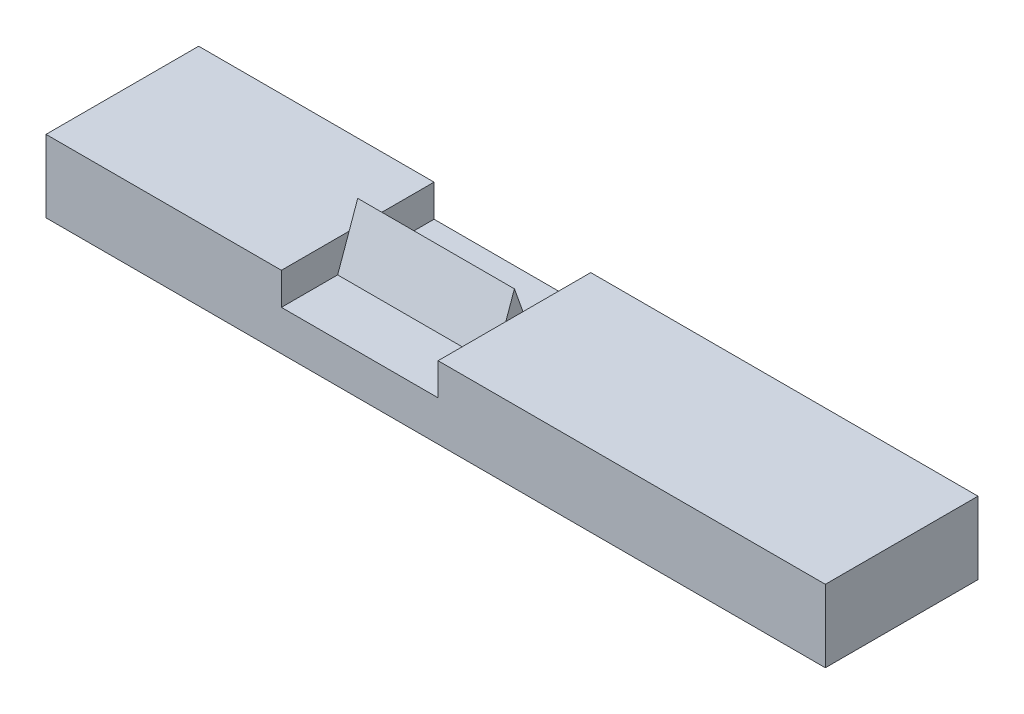
from build123d import *

# Parameters (mm, degrees)
SKETCH1_W                = 97
SKETCH1_H                = 19
BOSS_EXTRUDE1_DEPTH      = 10
SKETCH4_W                = 19.5
SKETCH4_H                = 19
CUT_EXTRUDE1_DEPTH       = 5
BOSS_EXTRUDE2_DEPTH      = 45.5
BOSS_EXTRUDE2_DEPTH_BACK = 29.5
SKETCH6_W                = 26.3
SKETCH6_H                = 19
SKETCH6_W_2              = 45.2
CUT_EXTRUDE2_DEPTH       = 2
SKETCH7_W                = 29.3
SKETCH7_H                = 19
SKETCH7_W_2              = 48.2
CUT_EXTRUDE3_DEPTH       = 1


with BuildPart() as part:
    # Sketch1 → Boss-Extrude1 (new body)
    with BuildSketch(Plane(origin=(0, 0, 0), x_dir=(1, 0, 0), z_dir=(0, 1, 0))):
        Rectangle(SKETCH1_W, SKETCH1_H)
    extrude(amount=-BOSS_EXTRUDE1_DEPTH)

    # Sketch4 → Cut-Extrude1 (cut)
    with BuildSketch(Plane(origin=(0, 0, 0), x_dir=(1, 0, 0), z_dir=(0, 1, 0))):
        with Locations((-9.45, 0)):
            Rectangle(SKETCH4_W, SKETCH4_H)
    extrude(amount=-CUT_EXTRUDE1_DEPTH, mode=Mode.SUBTRACT)

    # Sketch5 → Boss-Extrude2 (add, two sides: drawn at the far end of the back side and taken through both)
    with BuildSketch(Plane.ZY.offset(-0.3).offset(-BOSS_EXTRUDE2_DEPTH_BACK)):
        Polygon((-2.5, -5), (0, 2), (2.5, -5), align=None)
    extrude(amount=BOSS_EXTRUDE2_DEPTH + BOSS_EXTRUDE2_DEPTH_BACK)

    # Sketch6 → Cut-Extrude2 (cut)
    with BuildSketch(Plane(origin=(0, 0, 0), x_dir=(1, 0, 0), z_dir=(0, 1, 0))):
        with Locations((-32.35, 0)):
            Rectangle(SKETCH6_W, SKETCH6_H)
        with Locations((22.9, 0)):
            Rectangle(SKETCH6_W_2, SKETCH6_H)
    extrude(amount=CUT_EXTRUDE2_DEPTH, mode=Mode.SUBTRACT)

    # Sketch7 → Cut-Extrude3 (cut)
    with BuildSketch(Plane(origin=(0, 0, 0), x_dir=(1, 0, 0), z_dir=(0, 1, 0))):
        with Locations((-33.85, 0)):
            Rectangle(SKETCH7_W, SKETCH7_H)
        with Locations((24.4, 0)):
            Rectangle(SKETCH7_W_2, SKETCH7_H)
    extrude(amount=-CUT_EXTRUDE3_DEPTH, mode=Mode.SUBTRACT)


solid = part.part
